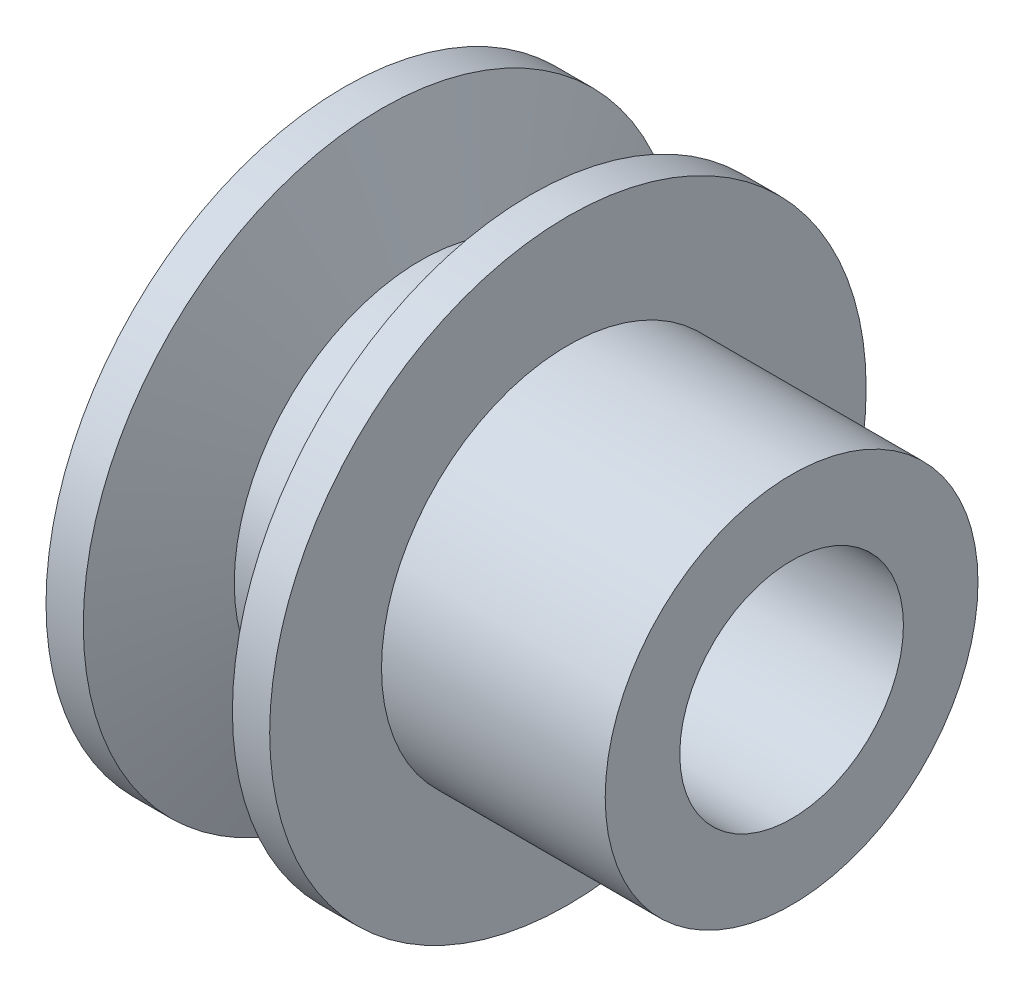
from build123d import *


with BuildPart() as part:
    # Sketch1 → Revolve1 (revolve)
    with BuildSketch(Plane.XY, mode=Mode.PRIVATE) as revolve1_sk:
        Polygon((-9.348739496, 35.217086835), (-9.348739496, 20), (-4.348739496, 15), (50.651260504, 15), (50.651260504, 25), (20.651260504, 25), (20.651260504, 40), (15.651260504, 40), (9.978991597, 25), (0.900020093, 25), (-4.348739496, 40), (-9.348739496, 40), align=None)
    revolve(revolve1_sk.sketch.rotate(Axis((-23.196778711, 0, 0), (1, 0, 0)), 90), axis=Axis((-23.196778711, 0, 0), (1, 0, 0)))


solid = part.part
